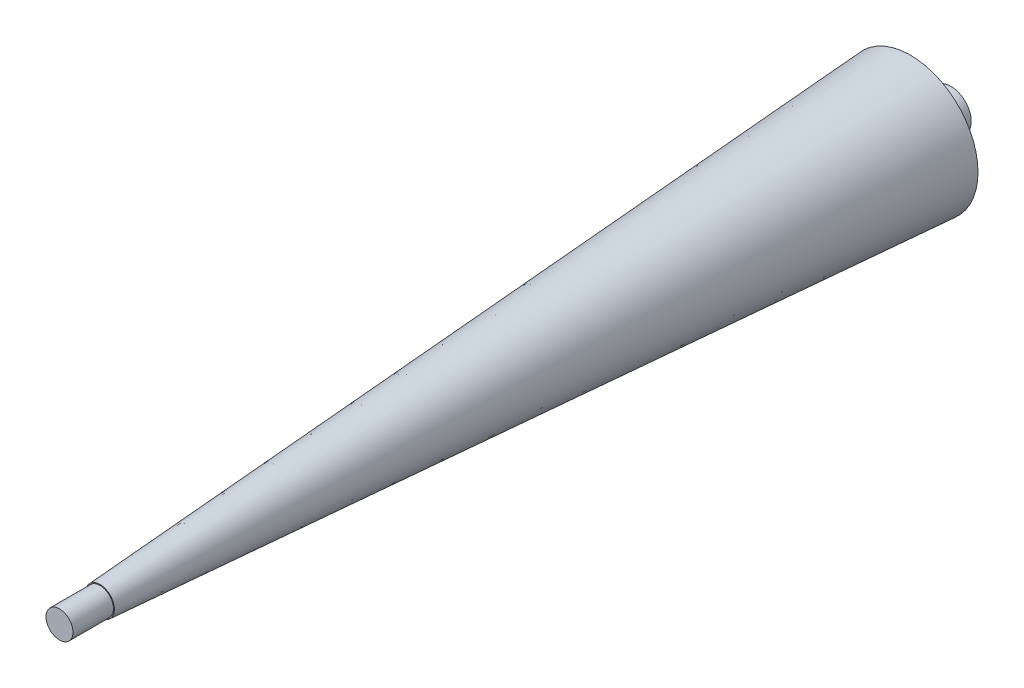
from build123d import *

# Parameters (mm, degrees)
SKETCH1_R           = 25
BOSS_EXTRUDE1_DEPTH = 300
BOSS_EXTRUDE1_TAPER = 3.75
SHELL1_T            = 5
SKETCH2_R           = 7.5
BOSS_EXTRUDE2_DEPTH = 15
SKETCH3_R           = 5
BOSS_EXTRUDE3_DEPTH = 15


with BuildPart() as part:
    # Sketch1 → Boss-Extrude1 (new body)
    with BuildSketch(Plane.XY):
        Circle(SKETCH1_R)
    extrude(amount=BOSS_EXTRUDE1_DEPTH, taper=BOSS_EXTRUDE1_TAPER)

    # Shell1 (no face opened: a closed hollow body)
    add(offset(amount=-SHELL1_T, mode=Mode.PRIVATE), mode=Mode.SUBTRACT)

    # Sketch2 → Boss-Extrude2 (add)
    with BuildSketch(Plane(origin=(0, 0, 0), x_dir=(-1, 0, 0), z_dir=(0, 0, -1))):
        Circle(SKETCH2_R)
    extrude(amount=BOSS_EXTRUDE2_DEPTH)

    # Sketch3 → Boss-Extrude3 (add)
    with BuildSketch(Plane.XY.offset(300)):
        Circle(SKETCH3_R)
    extrude(amount=BOSS_EXTRUDE3_DEPTH)


solid = part.part
